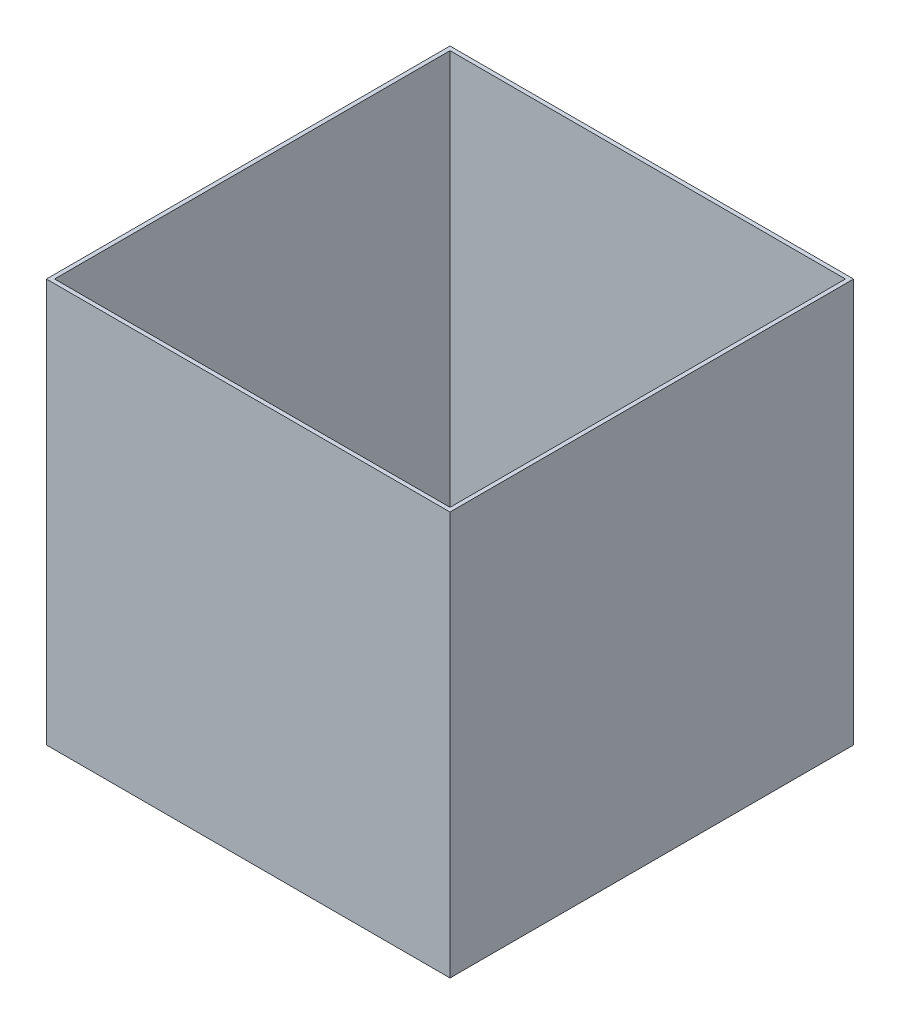
from build123d import *

# Parameters (mm, degrees)
SKETCH_1_W      = 200
SKETCH_1_H      = 200
SKETCH_1_W_2    = 196
SKETCH_1_H_2    = 196
EXTRUDE_1_DEPTH = 200


with BuildPart() as part:
    # 草图1 → 凸台-拉伸1 (new body)
    with BuildSketch(Plane(origin=(0, 0, 0), x_dir=(1, 0, 0), z_dir=(0, 1, 0))):
        with Locations((-100, 100)):
            Rectangle(SKETCH_1_W, SKETCH_1_H)
        with Locations((-100, 100)):
            Rectangle(SKETCH_1_W_2, SKETCH_1_H_2, mode=Mode.SUBTRACT)
    extrude(amount=EXTRUDE_1_DEPTH)


solid = part.part
